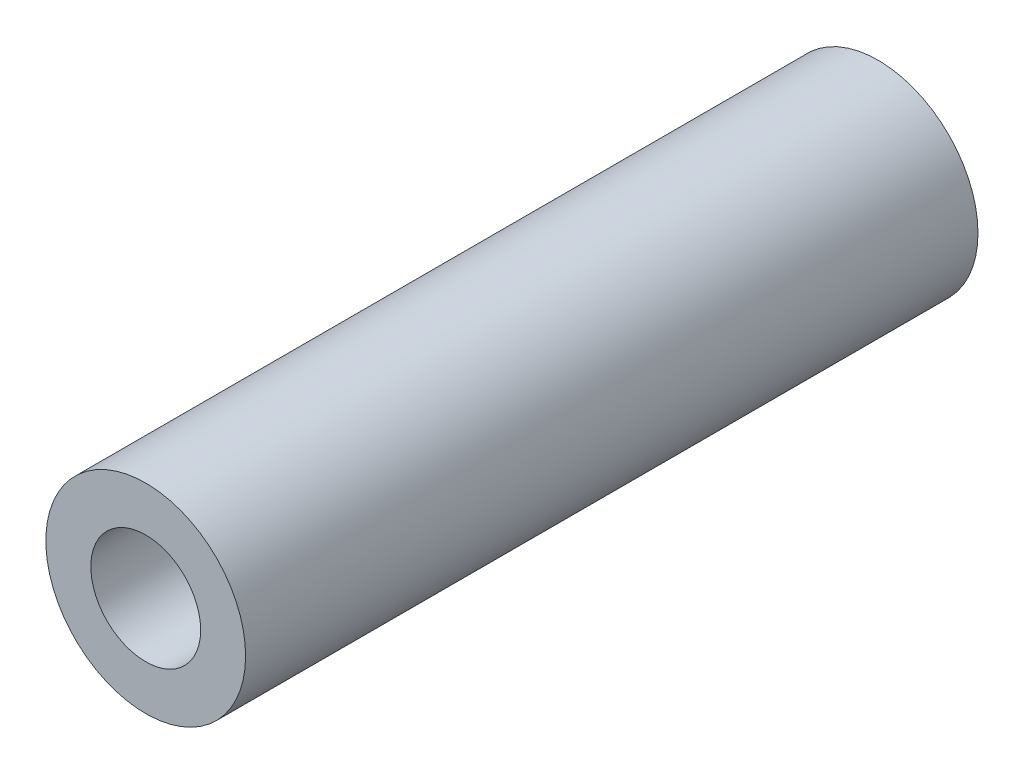
from build123d import *

# Parameters (mm, degrees)
SKIZZE1_R                       = 3
SKIZZE1_R_2                     = 1.65
AUFSATZ_LINEAR_AUSTRAGEN1_DEPTH = 22


with BuildPart() as part:
    # Skizze1 → Aufsatz-Linear austragen1 (new body)
    with BuildSketch(Plane.XY):
        Circle(SKIZZE1_R)
        Circle(SKIZZE1_R_2, mode=Mode.SUBTRACT)
    extrude(amount=AUFSATZ_LINEAR_AUSTRAGEN1_DEPTH)


solid = part.part
